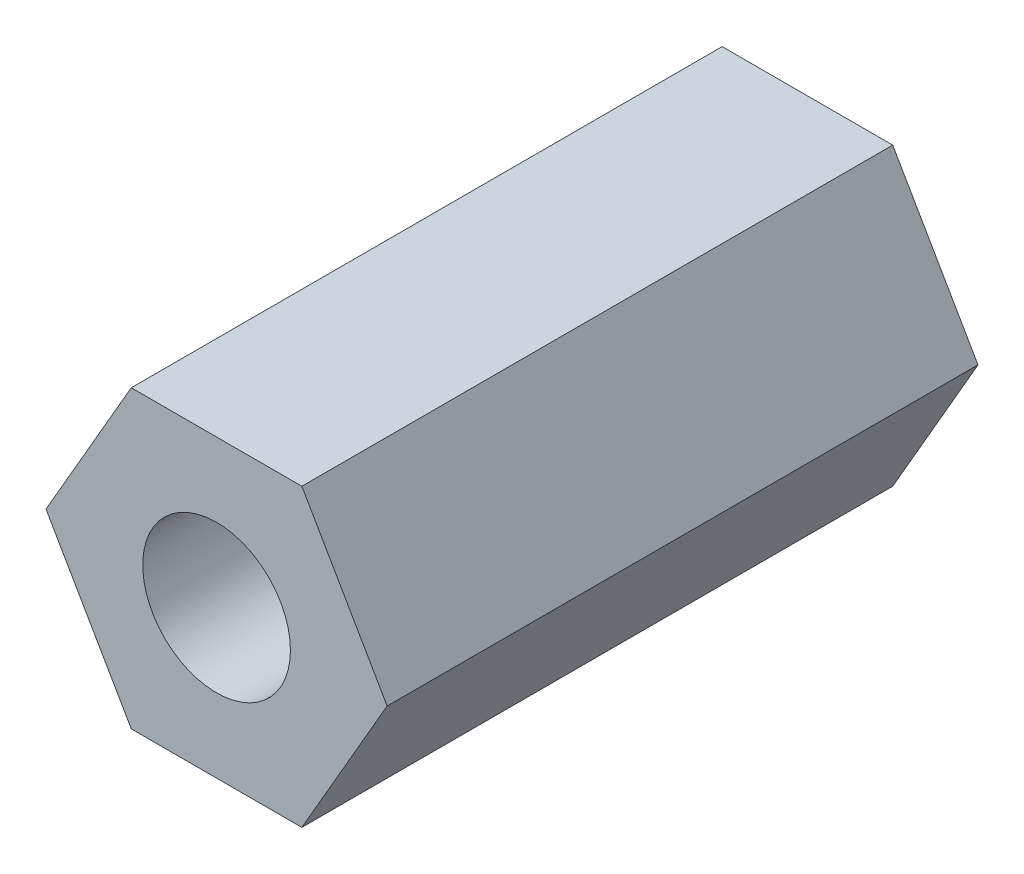
from build123d import *

# Parameters (mm, degrees)
SKETCH1_R           = 3.175
BOSS_EXTRUDE1_DEPTH = 25.4


with BuildPart() as part:
    # Sketch1 → Boss-Extrude1 (new body)
    with BuildSketch(Plane.XY):
        Polygon((7.332348419, 0), (3.666174209, 6.35), (-3.666174209, 6.35), (-7.332348419, 0), (-3.666174209, -6.35), (3.666174209, -6.35), align=None)
        Circle(SKETCH1_R, mode=Mode.SUBTRACT)
    extrude(amount=BOSS_EXTRUDE1_DEPTH)


solid = part.part
